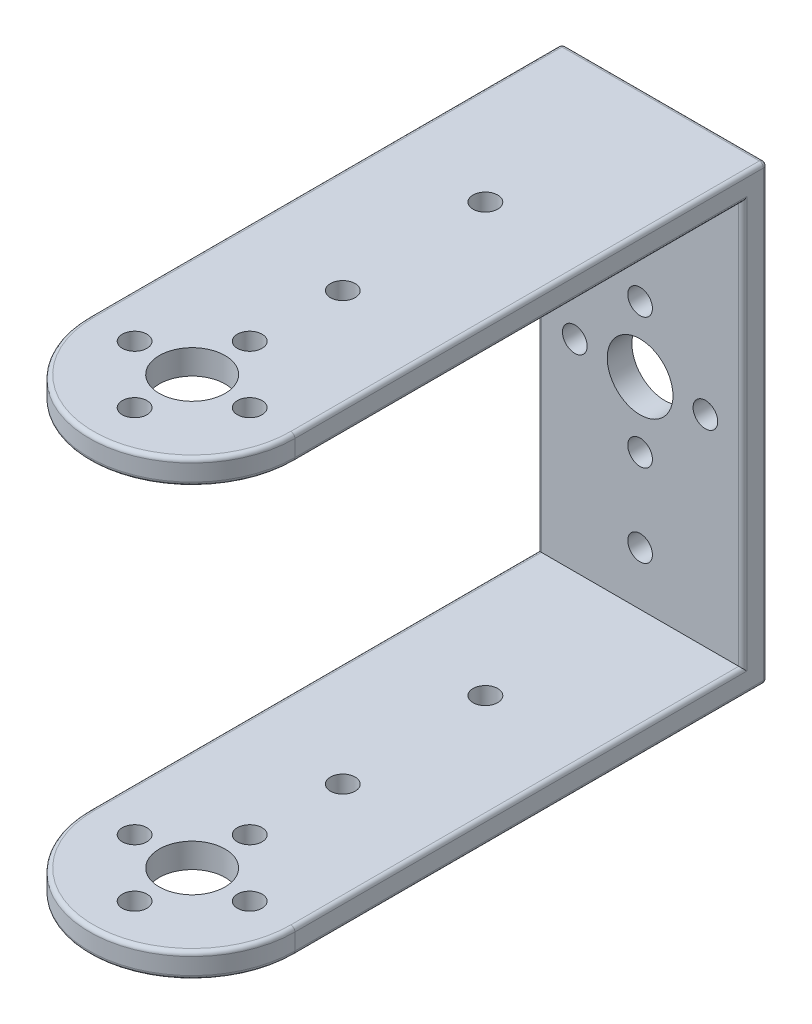
from build123d import *

# Parameters (mm, degrees)
SKETCH1_W                 = 25
SKETCH1_H                 = 55
BOSS_EXTRUDE1_DEPTH       = 3
F_8_0MM_DOWEL_HOLE1_D     = 8
F_8_0MM_DOWEL_HOLE1_DEPTH = 3
F_8_0MM_DOWEL_HOLE1_TIP   = 2.403442476
F_3_0MM_DOWEL_HOLE1_D     = 3
F_3_0MM_DOWEL_HOLE1_DEPTH = 3
F_3_0MM_DOWEL_HOLE1_TIP   = 0.901290929
SKETCH6_W                 = 25
SKETCH6_H                 = 3
BOSS_EXTRUDE2_DEPTH       = 67
CUT_EXTRUDE2_DEPTH        = 90.895772982
F_8_0MM_DOWEL_HOLE2_D     = 8
F_3_0MM_DOWEL_HOLE2_D     = 3
FILLET2_R                 = 0.5


with BuildPart() as part:
    # Sketch1 → Boss-Extrude1 (new body)
    with BuildSketch(Plane.XY):
        Rectangle(SKETCH1_W, SKETCH1_H)
    extrude(amount=BOSS_EXTRUDE1_DEPTH)

    # Ø8.0mm Dowel Hole1
    with Locations(Plane.XY.offset(3)):
        with Locations((0, 0)):
            Hole(F_8_0MM_DOWEL_HOLE1_D / 2, depth=F_8_0MM_DOWEL_HOLE1_DEPTH)
            with Locations((0, 0, -(F_8_0MM_DOWEL_HOLE1_DEPTH + F_8_0MM_DOWEL_HOLE1_TIP / 2))):  # 118° drill point
                Cone(0, F_8_0MM_DOWEL_HOLE1_D / 2, F_8_0MM_DOWEL_HOLE1_TIP, mode=Mode.SUBTRACT)

    # Ø3.0mm Dowel Hole1
    with Locations(Plane.XY.offset(3)):
        with Locations((0, -7.946297912), (-7.946297912, 0), (0, 7.946297912), (7.946297912, 0), (0, 0), (0, 18), (0, -36), (0, -18)):
            Hole(F_3_0MM_DOWEL_HOLE1_D / 2, depth=F_3_0MM_DOWEL_HOLE1_DEPTH)
            with Locations((0, 0, -(F_3_0MM_DOWEL_HOLE1_DEPTH + F_3_0MM_DOWEL_HOLE1_TIP / 2))):  # 118° drill point
                Cone(0, F_3_0MM_DOWEL_HOLE1_D / 2, F_3_0MM_DOWEL_HOLE1_TIP, mode=Mode.SUBTRACT)

    # Sketch6 → Boss-Extrude2 (add)
    with BuildSketch(Plane.XY.offset(3)):
        with Locations((0, 26)):
            Rectangle(SKETCH6_W, SKETCH6_H)
        with Locations((0, -26)):
            Rectangle(SKETCH6_W, SKETCH6_H)
    extrude(amount=BOSS_EXTRUDE2_DEPTH)

    # Sketch8 → Cut-Extrude2 (cut, through all)
    with BuildSketch(Plane(origin=(0, 27.5, 0), x_dir=(1, 0, 0), z_dir=(0, 1, 0))):
        with BuildLine():
            Line((-12.5, -57.5), (-12.5, -70))
            Line((-12.5, -70), (0, -70))
            ThreePointArc((0, -70), (-8.838834765, -66.338834765), (-12.5, -57.5))
        make_face()
        with BuildLine():
            ThreePointArc((12.5, -57.5), (8.838834765, -66.338834765), (0, -70))
            Line((0, -70), (12.5, -70))
            Line((12.5, -70), (12.5, -57.5))
        make_face()
    extrude(amount=-CUT_EXTRUDE2_DEPTH, mode=Mode.SUBTRACT)

    # Ø8.0mm Dowel Hole2 (through all)
    with Locations(Plane(origin=(0, 27.5, 0), x_dir=(1, 0, 0), z_dir=(0, 1, 0))):
        with Locations((0, -57.5)):
            Hole(F_8_0MM_DOWEL_HOLE2_D / 2)

    # Ø3.0mm Dowel Hole2 (through all)
    with Locations(Plane(origin=(0, 27.5, 0), x_dir=(1, 0, 0), z_dir=(0, 1, 0))):
        with Locations((0, -57.5), (0.326210902, -39.5), (-0.326210902, -21.5), (0, -50.5), (7, -57.5), (0, -64.5), (-7, -57.5)):
            Hole(F_3_0MM_DOWEL_HOLE2_D / 2)

    # Fillet2
    fillet2_edges = [part.edges().sort_by_distance(p)[0] for p in [
        (12.5, 27.5, 28.75),
        (12.5, 24.5, 30.25),
        (12.5, -24.5, 30.25),
        (12.5, -27.5, 28.75),
        (0, -27.5, 0),
        (-12.5, 0, 0),
        (0, 27.5, 0),
        (-12.5, 0, 3),
        (12.5, 0, 0),
        (12.5, 0, 3),
        (-12.5, -24.5, 30.25),
        (-12.5, 24.5, 30.25),
        (-12.5, -27.5, 28.75),
        (-12.5, 27.5, 28.75),
        (0, 27.5, 70),
        (0, 24.5, 70),
        (0, -24.5, 70),
        (0, -27.5, 70),
    ]]
    fillet(fillet2_edges, radius=FILLET2_R)


solid = part.part
